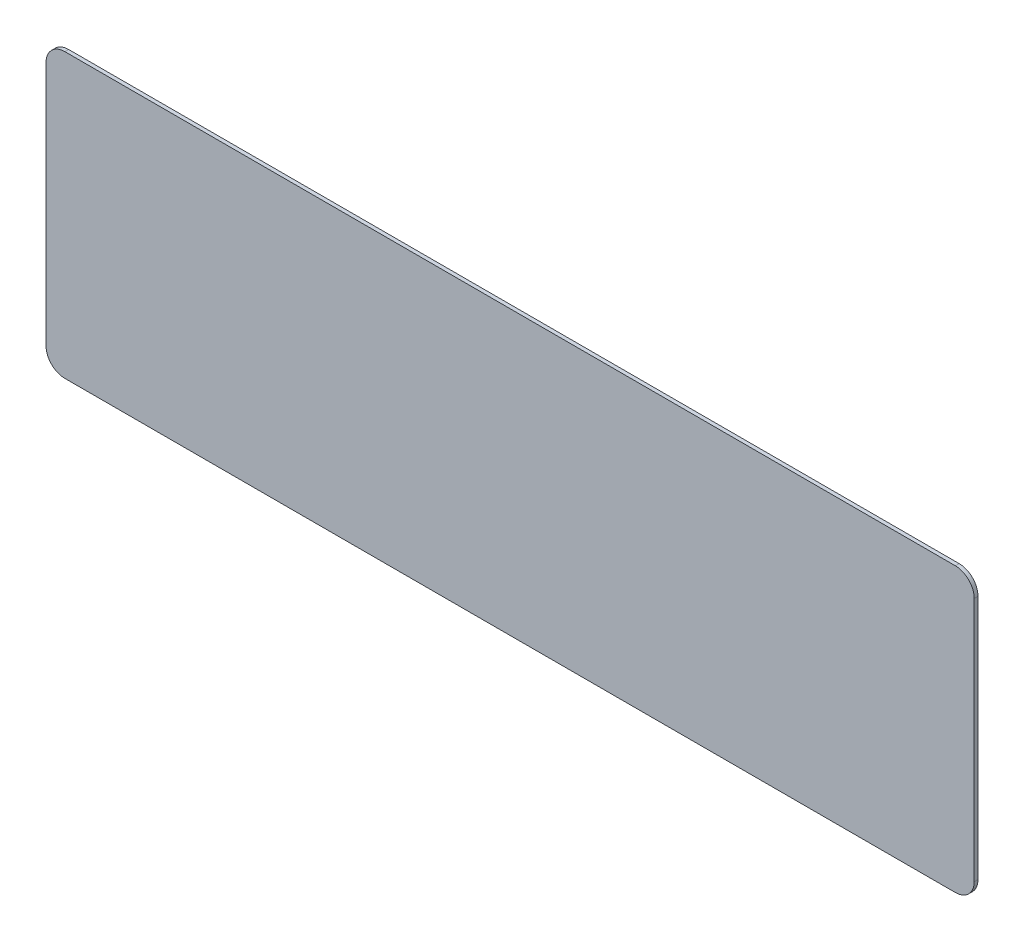
from build123d import *

# Parameters (mm, degrees)
SKETCH1_W           = 492
SKETCH1_H           = 150
BOSS_EXTRUDE1_DEPTH = 2
FILLET1_R           = 10


with BuildPart() as part:
    # Sketch1 → Boss-Extrude1 (new body)
    with BuildSketch(Plane.XY):
        with Locations((123, -292)):
            Rectangle(SKETCH1_W, SKETCH1_H)
    extrude(amount=BOSS_EXTRUDE1_DEPTH)

    # Fillet1
    fillet1_edges = [part.edges().sort_by_distance(p)[0] for p in [
        (-123, -367, 1),
        (-123, -217, 1),
        (369, -217, 1),
        (369, -367, 1),
    ]]
    fillet(fillet1_edges, radius=FILLET1_R)


solid = part.part
